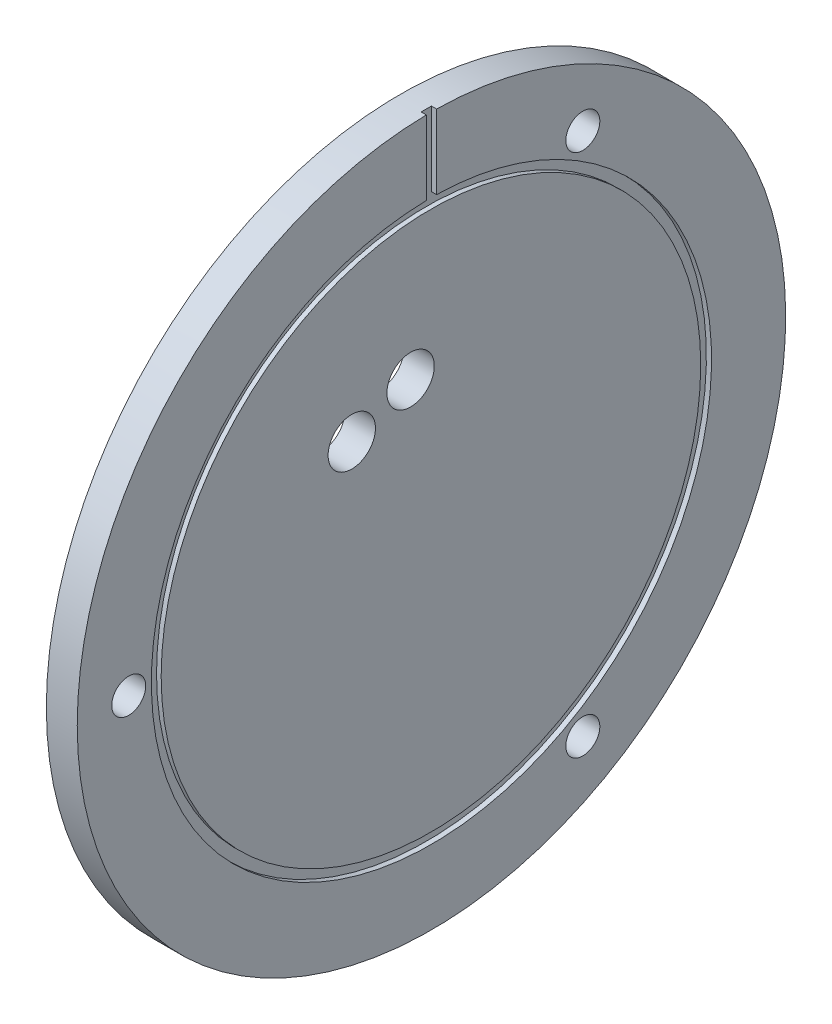
from build123d import *

# Parameters (mm, degrees)
AXIAL_HOLES_DEPTH                            = 167.945530039
AXIAL_HOLES_DEPTH_BACK                       = 167.945530039
SKETCH2_R                                    = 2.3
SKETCH2_R_2                                  = 1.65
DRY_START                                    = 159.2
SKETCH3_W                                    = 1
SKETCH3_H                                    = 8.8
DRY_INTERFACE_VENT_NOT_A_COOLANT_PASSA_DEPTH = 0.5


with BuildPart() as part:
    # Axial profile (mm) → Full revolution (revolve)
    with BuildSketch(Plane.XY, mode=Mode.PRIVATE) as full_revolution_sk:
        Polygon((156.7, 0), (159.65, 0), (159.65, 26.2), (159.2, 26.2), (159.2, 27.2), (159.7, 27.2), (159.7, 34.4), (156.7, 34.4), align=None)
    revolve(full_revolution_sk.sketch.rotate(Axis((-110, 0, 0), (1, 0, 0)), 90), axis=Axis((-110, 0, 0), (1, 0, 0)))

    # Sketch2 → Axial holes (cut, two sides: drawn at the far end of the back side and taken through both)
    with BuildSketch(Plane(origin=(0, 0, 0), x_dir=(0, 0, -1), z_dir=(1, 0, 0)).offset(-AXIAL_HOLES_DEPTH_BACK)):
        with Locations(Location((-1.977382665, 12.848733704, 0), (0, 0, 180))):
            Circle(SKETCH2_R)
        with Locations(Location((-7.687206041, 10.483647423, 0), (0, 0, 180))):
            Circle(SKETCH2_R)
        with Locations((-29.4, 0)):
            Circle(SKETCH2_R_2)
        with Locations((14.7, -25.461146871)):
            Circle(SKETCH2_R_2)
        with Locations((14.7, 25.461146871)):
            Circle(SKETCH2_R_2)
    extrude(amount=AXIAL_HOLES_DEPTH + AXIAL_HOLES_DEPTH_BACK, mode=Mode.SUBTRACT)

    # Sketch3 → Dry interface vent - NOT a coolant passage (cut)
    with BuildSketch(Plane(origin=(0, 0, 0), x_dir=(0, 0, -1), z_dir=(1, 0, 0)).offset(DRY_START)):
        with Locations((0, 30.6)):
            Rectangle(SKETCH3_W, SKETCH3_H)
    extrude(amount=DRY_INTERFACE_VENT_NOT_A_COOLANT_PASSA_DEPTH, mode=Mode.SUBTRACT)


solid = part.part
